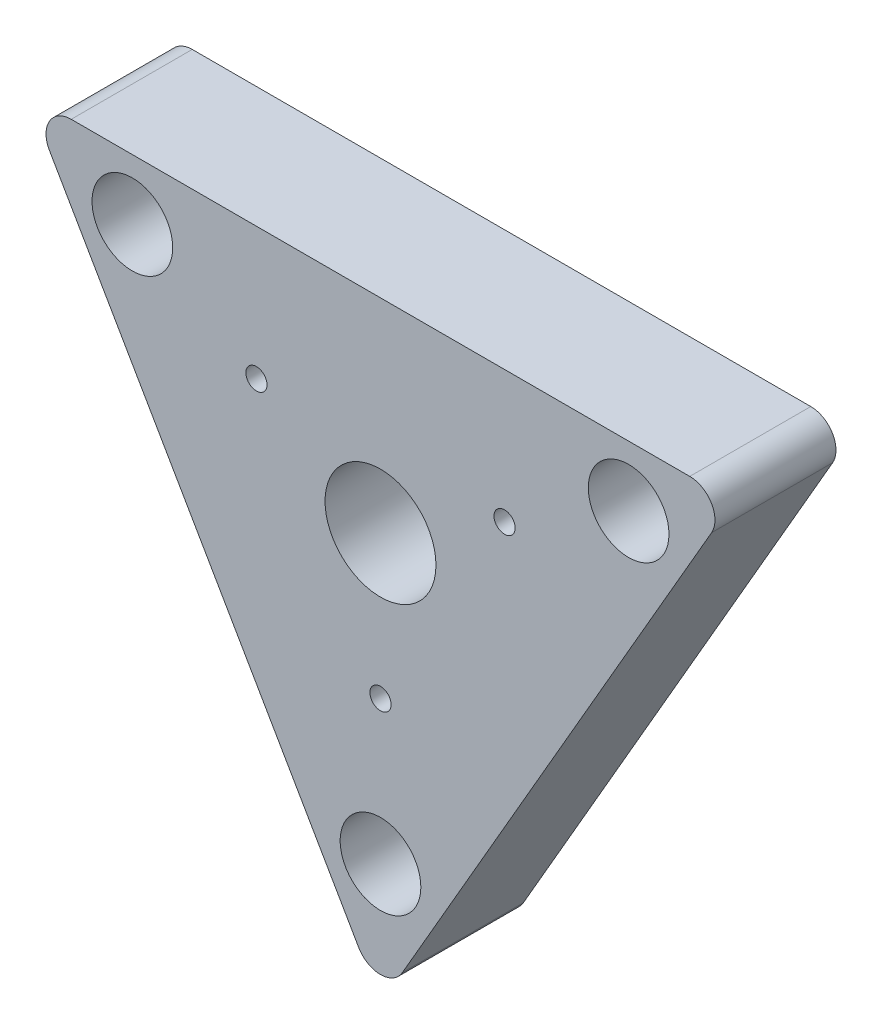
from build123d import *

# Parameters (mm, degrees)
IZIM2_R                              = 8
IZIM2_R_2                            = 11
Y_KSEKLIK_EKSTR_ZYON1_DEPTH          = 24
M4_HELISARMAL_I_IN_Z_VANA_MATKAB_1_D = 4.2


with BuildPart() as part:
    # Çizim2 → Yükseklik-Ekstrüzyon1 (new body)
    with BuildSketch(Plane.XY):
        with BuildLine():
            Line((-52.954462088, 36.177194256), (69.725029836, 36.177194256))
            ThreePointArc((69.725029836, 36.177194256), (74.055156855, 33.677194256), (74.055156855, 28.677194256))
            Line((74.055156855, 28.677194256), (12.715410893, -77.566362274))
            ThreePointArc((12.715410893, -77.566362274), (8.385283874, -80.066362274), (4.055156855, -77.566362274))
            Line((4.055156855, -77.566362274), (-57.284589107, 28.677194256))
            ThreePointArc((-57.284589107, 28.677194256), (-57.284589107, 33.677194256), (-52.954462088, 36.177194256))
        make_face()
        with Locations((57.600674183, 24.177194256)):
            Circle(IZIM2_R, mode=Mode.SUBTRACT)
        with Locations((8.385283874, -61.066362274)):
            Circle(IZIM2_R, mode=Mode.SUBTRACT)
        with Locations((-40.830106435, 24.177194256)):
            Circle(IZIM2_R, mode=Mode.SUBTRACT)
        with Locations((8.385283874, -4.237324587)):
            Circle(IZIM2_R_2, mode=Mode.SUBTRACT)
    extrude(amount=Y_KSEKLIK_EKSTR_ZYON1_DEPTH)

    # M4 Helisarmal için Zıvana matkabı1 (through all)
    with Locations(Plane(origin=(-16.222411281, 9.969934834, 24), x_dir=(1, 0, 0), z_dir=(0, 0, 1))):
        with Locations((0, 0), (49.215390309, 0), (24.607695155, -42.621778265)):
            Hole(M4_HELISARMAL_I_IN_Z_VANA_MATKAB_1_D / 2)


solid = part.part
